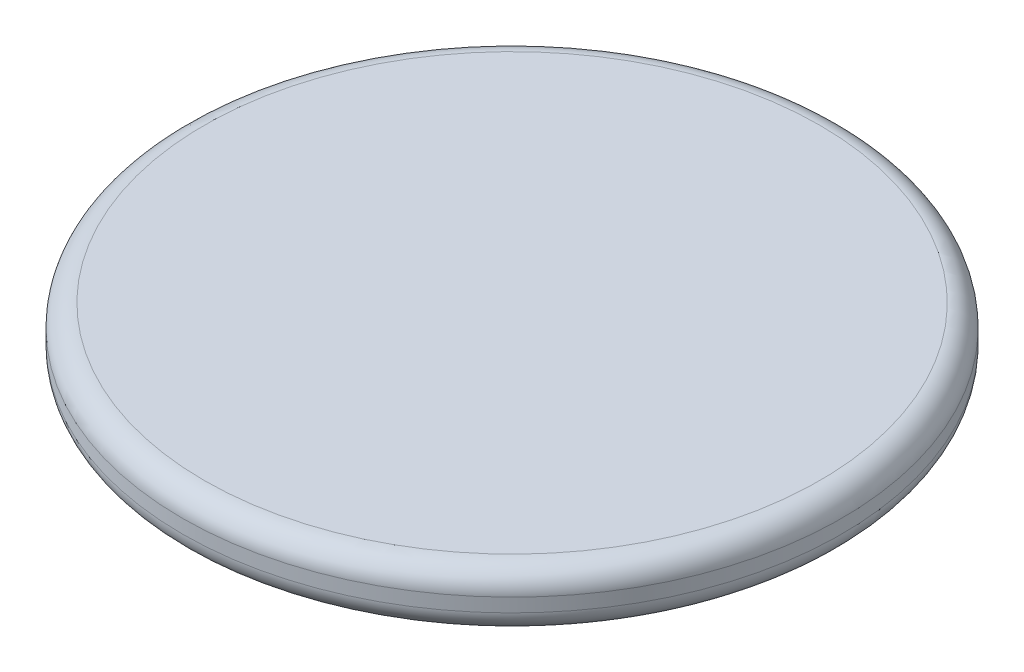
from build123d import *

# Parameters (mm, degrees)
SKETCH1_R           = 115
BOSS_EXTRUDE4_DEPTH = 20
SKETCH4_R           = 30
BOSS_EXTRUDE5_DEPTH = 50
FILLET1_R           = 7.62


with BuildPart() as part:
    # Sketch1 → Boss-Extrude4 (new body)
    with BuildSketch(Plane(origin=(0, 0, 0), x_dir=(1, 0, 0), z_dir=(0, 1, 0))):
        with Locations(Location((-132.587246663, 38.436908881, 0), (0, 0, 270))):
            Circle(SKETCH1_R)
    extrude(amount=BOSS_EXTRUDE4_DEPTH)

    # Sketch4 → Boss-Extrude5 (add)
    with BuildSketch(Plane(origin=(0, 0, 0), x_dir=(-1, 0, 0), z_dir=(0, -1, 0))):
        with Locations(Location((131.263903024, 37.444401151, 0), (0, 0, 90))):
            Circle(SKETCH4_R)
    extrude(amount=BOSS_EXTRUDE5_DEPTH)

    # Fillet1
    fillet1_edges = [part.edges().sort_by_distance(p)[0] for p in [
        (-132.587246663, 0, -153.436908881),
        (-132.587246663, 20, -153.436908881),
    ]]
    fillet(fillet1_edges, radius=FILLET1_R)


solid = part.part
